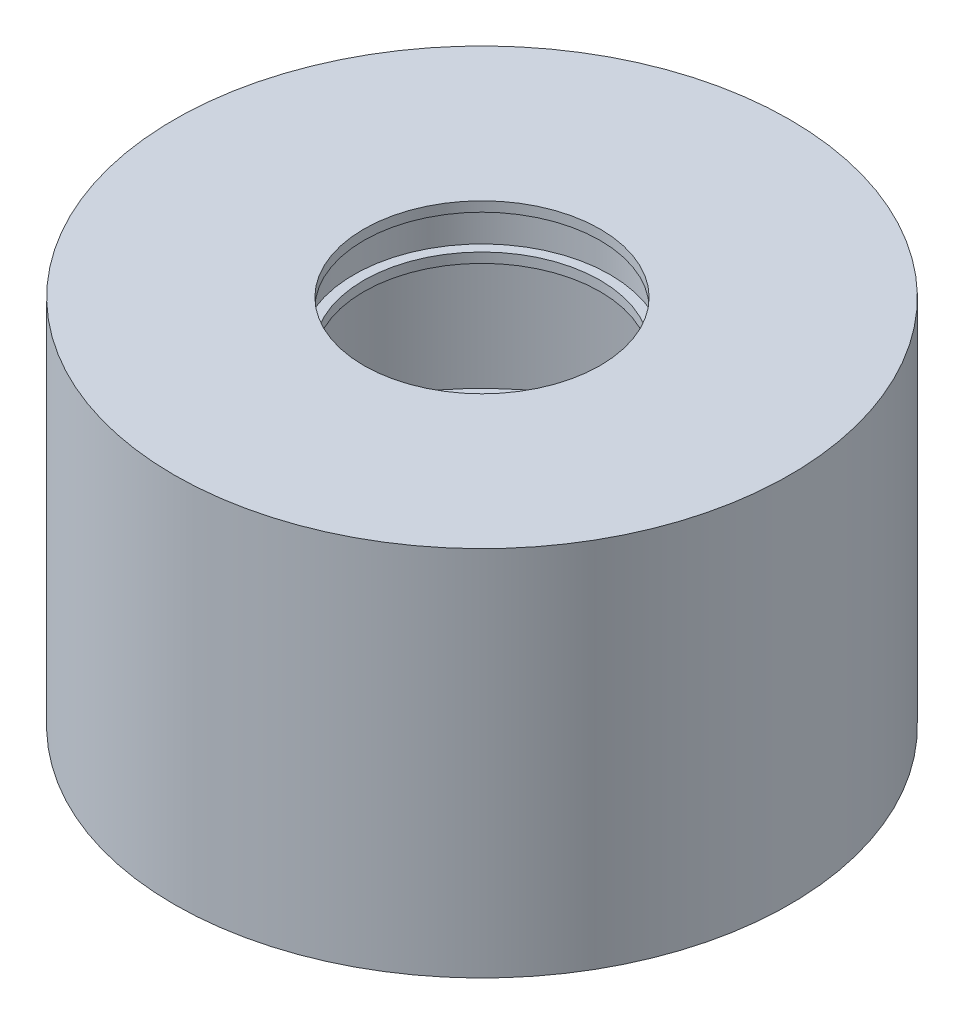
from build123d import *

# Parameters (mm, degrees)
CUT_EXTRUDE5_START = -2.5
SKETCH3_R          = 2
CUT_EXTRUDE5_DEPTH = 50


with BuildPart() as part:
    # Sketch2 → Revolve1 (revolve)
    with BuildSketch(Plane(origin=(0, 0, 0), x_dir=(0, 0, -1), z_dir=(1, 0, 0))):
        Polygon((47, -37.75), (62.5, -37.75), (62.5, 37.75), (24, 37.75), (24, 35.75), (26, 35.75), (26, 28.75), (24, 28.75), (24, 26.75), (42.5, 26.75), (42.5, 17.75), (53, 17.75), (53, -15.75), (47, -15.75), (47, -25.75), (50, -25.75), (50, -35.75), (47, -35.75), align=None)
    revolve(axis=Axis((0, -15.437269333, 0), (0, 1, 0)))

    # Sketch3 → Cut-Extrude5 (cut)
    with BuildSketch(Plane.XZ.offset(25.75).offset(CUT_EXTRUDE5_START)):
        with Locations(Location((-47.552825815, 15.450849719, 0), (0, 0, 270))):
            Circle(SKETCH3_R)
        with Locations(Location((-40.450849719, 29.389262615, 0), (0, 0, 270))):
            Circle(SKETCH3_R)
        with Locations(Location((-29.389262615, 40.450849719, 0), (0, 0, 270))):
            Circle(SKETCH3_R)
        with Locations(Location((-15.450849719, 47.552825815, 0), (0, 0, 270))):
            Circle(SKETCH3_R)
        with Locations(Location((0, 50, 0), (0, 0, 270))):
            Circle(SKETCH3_R)
        with Locations(Location((15.450849719, 47.552825815, 0), (0, 0, 270))):
            Circle(SKETCH3_R)
        with Locations(Location((29.389262615, 40.450849719, 0), (0, 0, 270))):
            Circle(SKETCH3_R)
        with Locations(Location((40.450849719, 29.389262615, 0), (0, 0, 270))):
            Circle(SKETCH3_R)
        with Locations(Location((47.552825815, 15.450849719, 0), (0, 0, 270))):
            Circle(SKETCH3_R)
        with Locations(Location((50, 0, 0), (0, 0, 270))):
            Circle(SKETCH3_R)
        with Locations(Location((47.552825815, -15.450849719, 0), (0, 0, 270))):
            Circle(SKETCH3_R)
        with Locations(Location((40.450849719, -29.389262615, 0), (0, 0, 270))):
            Circle(SKETCH3_R)
        with Locations(Location((29.389262615, -40.450849719, 0), (0, 0, 270))):
            Circle(SKETCH3_R)
        with Locations(Location((15.450849719, -47.552825815, 0), (0, 0, 270))):
            Circle(SKETCH3_R)
        with Locations(Location((0, -50, 0), (0, 0, 270))):
            Circle(SKETCH3_R)
        with Locations(Location((-15.450849719, -47.552825815, 0), (0, 0, 270))):
            Circle(SKETCH3_R)
        with Locations(Location((-29.389262615, -40.450849719, 0), (0, 0, 270))):
            Circle(SKETCH3_R)
        with Locations(Location((-40.450849719, -29.389262615, 0), (0, 0, 270))):
            Circle(SKETCH3_R)
        with Locations(Location((-47.552825815, -15.450849719, 0), (0, 0, 270))):
            Circle(SKETCH3_R)
        with Locations(Location((-50, 0, 0), (0, 0, 270))):
            Circle(SKETCH3_R)
    extrude(amount=-CUT_EXTRUDE5_DEPTH, mode=Mode.SUBTRACT)


solid = part.part
